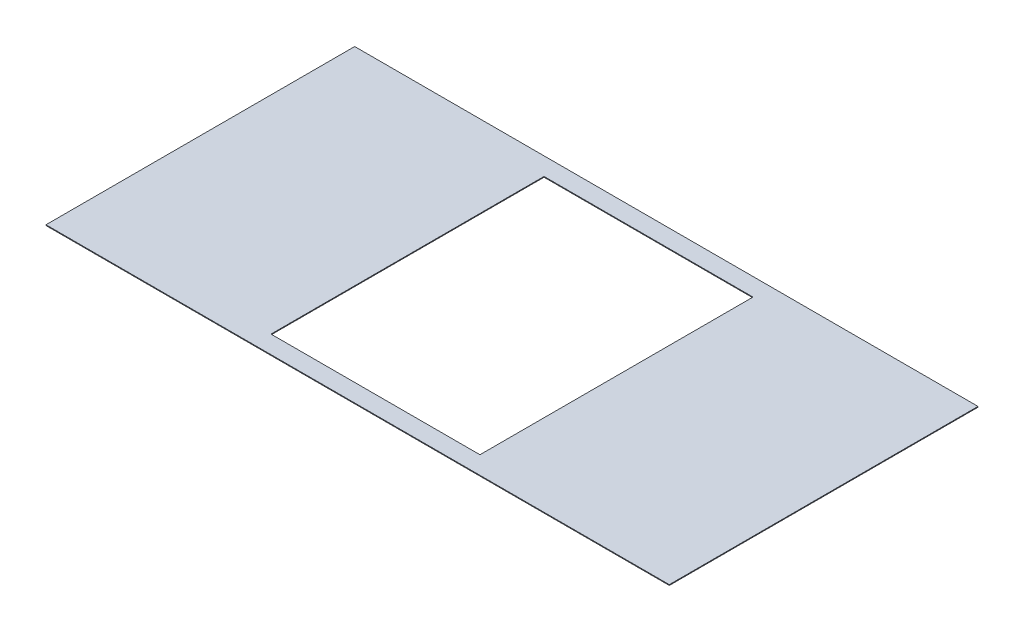
from build123d import *

# Parameters (mm, degrees)
CROQUIS1_W              = 1050
CROQUIS1_H              = 520
SALIENTE_EXTRUIR1_DEPTH = 1.25
CROQUIS2_W              = 352
CROQUIS2_H              = 460
CORTAR_EXTRUIR1_DEPTH   = 1.25


with BuildPart() as part:
    # Croquis1 → Saliente-Extruir1 (new body)
    with BuildSketch(Plane(origin=(0, 0, 0), x_dir=(1, 0, 0), z_dir=(0, 1, 0))):
        Rectangle(CROQUIS1_W, CROQUIS1_H)
    extrude(amount=SALIENTE_EXTRUIR1_DEPTH)

    # Croquis2 → Cortar-Extruir1 (cut)
    with BuildSketch(Plane(origin=(0, 1.25, 0), x_dir=(1, 0, 0), z_dir=(0, 1, 0))):
        Rectangle(CROQUIS2_W, CROQUIS2_H)
    extrude(amount=-CORTAR_EXTRUIR1_DEPTH, mode=Mode.SUBTRACT)


solid = part.part
